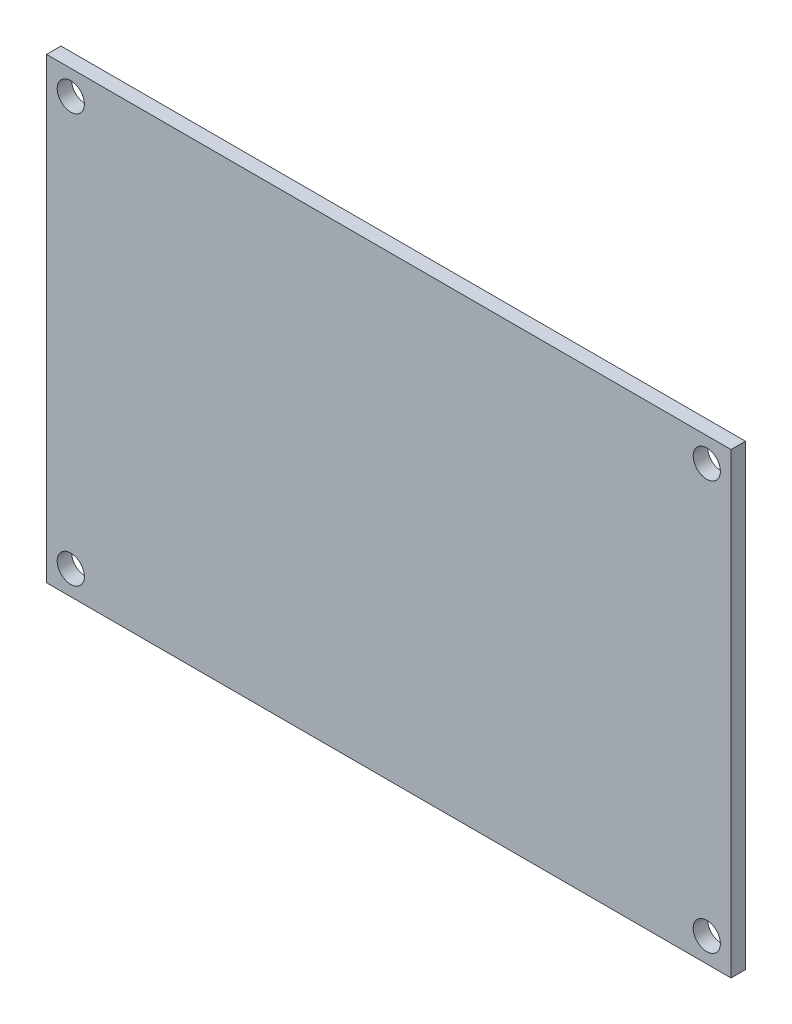
from build123d import *

# Parameters (mm, degrees)
SKETCH1_W           = 60.1472
SKETCH1_H           = 40.2082
SKETCH1_R           = 1.1938
BOSS_EXTRUDE1_DEPTH = 1.27


with BuildPart() as part:
    # Sketch1 → Boss-Extrude1 (new body)
    with BuildSketch(Plane.XY):
        with Locations((30.0736, 20.1041)):
            Rectangle(SKETCH1_W, SKETCH1_H)
        with Locations((2.1336, 38.0746)):
            Circle(SKETCH1_R, mode=Mode.SUBTRACT)
        with Locations((58.0136, 38.0746)):
            Circle(SKETCH1_R, mode=Mode.SUBTRACT)
        with Locations((2.1336, 2.1336)):
            Circle(SKETCH1_R, mode=Mode.SUBTRACT)
        with Locations((58.0136, 2.1336)):
            Circle(SKETCH1_R, mode=Mode.SUBTRACT)
    extrude(amount=BOSS_EXTRUDE1_DEPTH)


solid = part.part
